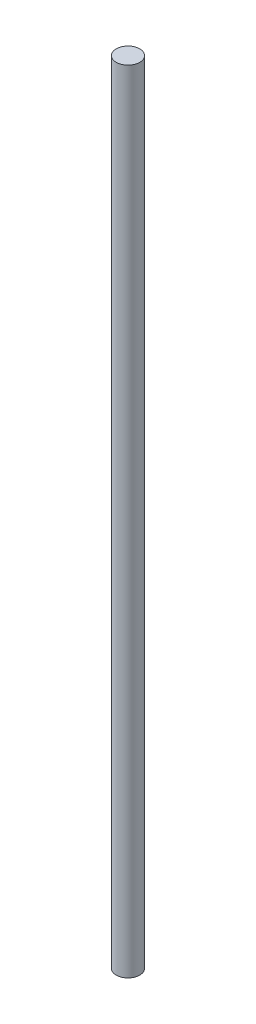
from build123d import *

# Parameters (mm, degrees)
IZIM1_R                     = 2
Y_KSEKLIK_EKSTR_ZYON1_DEPTH = 135


with BuildPart() as part:
    # Çizim1 → Yükseklik-Ekstrüzyon1 (new body)
    with BuildSketch(Plane(origin=(0, 0, 0), x_dir=(1, 0, 0), z_dir=(0, 1, 0))):
        with Locations(Location((0, 0, 0), (0, 0, 270))):
            Circle(IZIM1_R)
    extrude(amount=Y_KSEKLIK_EKSTR_ZYON1_DEPTH)


solid = part.part
